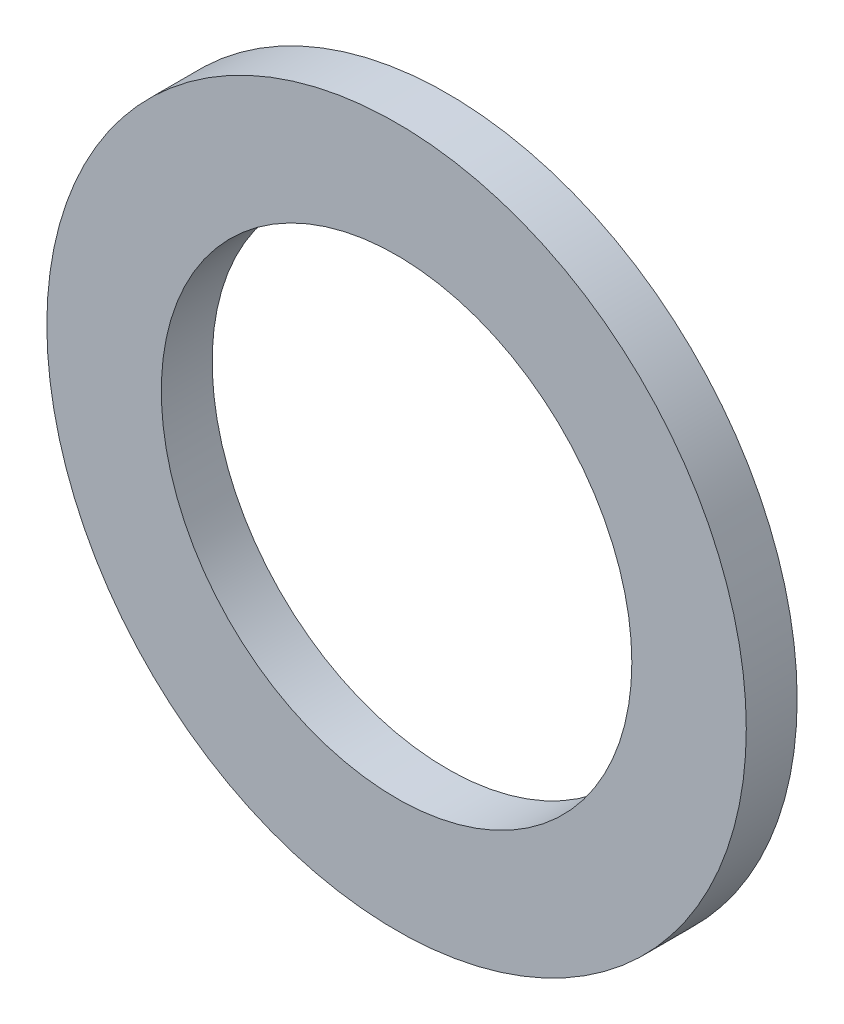
from build123d import *

# Parameters (mm, degrees)
SKETCH1_R           = 5.5
SKETCH1_R_2         = 3.7
BOSS_EXTRUDE1_DEPTH = 0.8


with BuildPart() as part:
    # Sketch1 → Boss-Extrude1 (new body)
    with BuildSketch(Plane.XY):
        with Locations((-6.053429189, 8.863949884)):
            Circle(SKETCH1_R)
        with Locations((-6.053429189, 8.863949884)):
            Circle(SKETCH1_R_2, mode=Mode.SUBTRACT)
    extrude(amount=BOSS_EXTRUDE1_DEPTH)


solid = part.part
